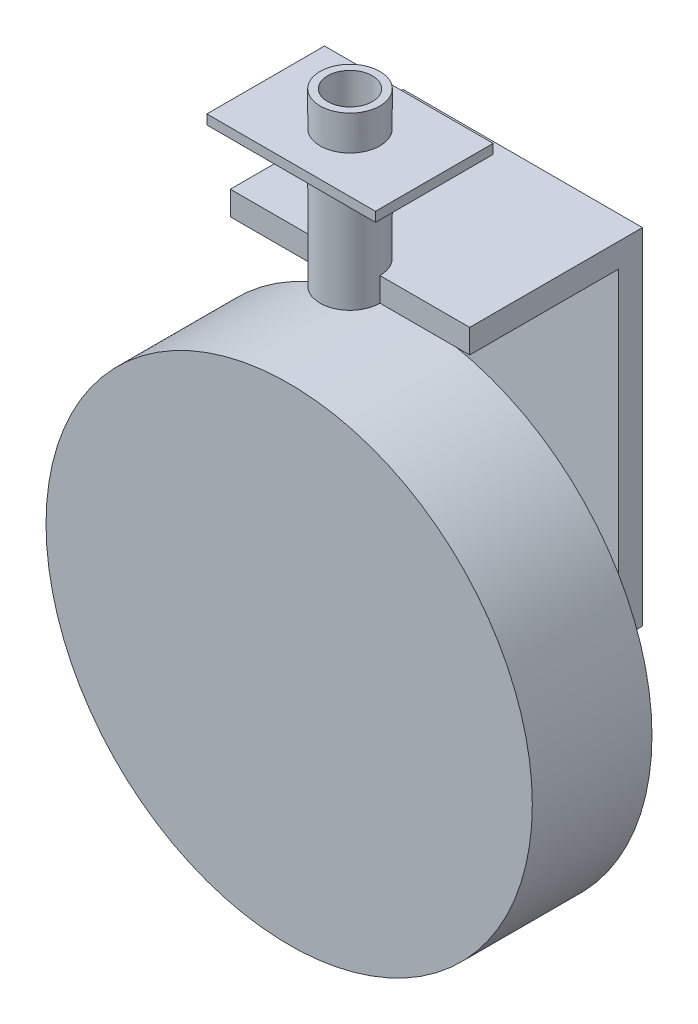
from build123d import *

# Parameters (mm, degrees)
SKETCH1_R                = 101.6
BOSS_EXTRUDE1_DEPTH      = 50
SKETCH4_W                = 12.5
SKETCH4_H                = 71.371504998
EXTRUDE_THIN1_DEPTH      = 50
EXTRUDE_THIN1_DEPTH_BACK = 50
SKETCH5_R                = 9.366113587
CUT_EXTRUDE1_DEPTH       = 50
SKETCH6_W                = 70.465682624
SKETCH6_H                = 49.159233517
BOSS_EXTRUDE2_DEPTH      = 4


with BuildPart() as part:
    # Sketch1 → Boss-Extrude1 (new body)
    with BuildSketch(Plane.XY):
        Circle(SKETCH1_R)
    extrude(amount=BOSS_EXTRUDE1_DEPTH)



with BuildPart() as body_2:
    # Sketch4 → Revolve-Thin1 (revolve)
    with BuildSketch(Plane(origin=(0, 0, 0), x_dir=(0, 0, -1), z_dir=(1, 0, 0)), mode=Mode.PRIVATE) as revolve_thin1_sk:
        with Locations((-30.829616759, 159.903955702)):
            Rectangle(SKETCH4_W, SKETCH4_H)
    revolve(revolve_thin1_sk.sketch.rotate(Axis((0, 124.218203203, 24.579616759), (0, 1, 0)), 180), axis=Axis((0, 124.218203203, 24.579616759), (0, 1, 0)))


with BuildPart() as part_1:
    add(part.part)

    add(body_2.part)  # Extrude-Thin1 merges body 2
    # Sketch3 → Extrude-Thin1 (add, two sides: drawn at the far end of the back side and taken through both)
    with BuildSketch(Plane(origin=(0, 0, 0), x_dir=(0, 0, -1), z_dir=(1, 0, 0)).offset(-EXTRUDE_THIN1_DEPTH_BACK)):
        Polygon((-24.579616759, 0), (37.637102953, 0), (37.637102953, 124.218203203), (-24.579616759, 124.218203203), (-24.579616759, 134.218203203), (47.637102953, 134.218203203), (47.637102953, -10), (-24.579616759, -10), align=None)
    extrude(amount=EXTRUDE_THIN1_DEPTH + EXTRUDE_THIN1_DEPTH_BACK)

    # Sketch5 → Cut-Extrude1 (cut)
    with BuildSketch(Plane(origin=(0, 195.589708201, 0), x_dir=(1, 0, 0), z_dir=(0, 1, 0))):
        with Locations(Location((0, -24.579616759, 0), (0, 0, 270))):
            Circle(SKETCH5_R)
    extrude(amount=-CUT_EXTRUDE1_DEPTH, mode=Mode.SUBTRACT)

    # Sketch6 → Boss-Extrude2 (add)
    with BuildSketch(Plane(origin=(0, 177.126182074, 0), x_dir=(1, 0, 0), z_dir=(0, 1, 0))):
        with Locations((0, -24.579616759)):
            Rectangle(SKETCH6_W, SKETCH6_H)
    extrude(amount=BOSS_EXTRUDE2_DEPTH)


solid = part_1.part
